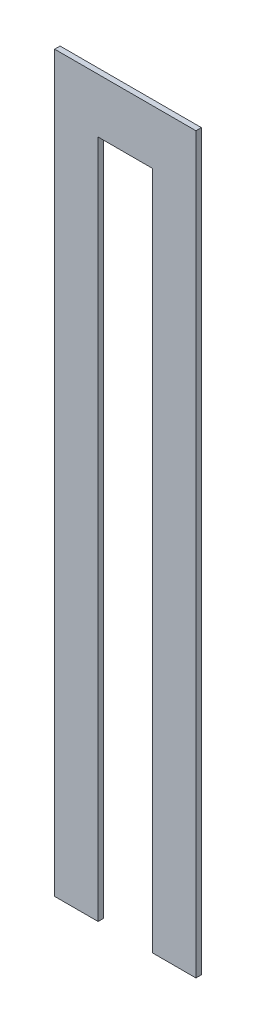
from build123d import *

# Parameters (mm, degrees)
EXTRUDE_1_DEPTH = 0.5


with BuildPart() as part:
    # 草图1 → 凸台-拉伸1 (new body)
    with BuildSketch(Plane.XY):
        Polygon((-2.5, 0), (-2.5, 62.5), (2.5, 62.5), (2.5, 0), (6.5, 0), (6.5, 67.5), (-6.5, 67.5), (-6.5, 0), align=None)
    extrude(amount=EXTRUDE_1_DEPTH)


solid = part.part
